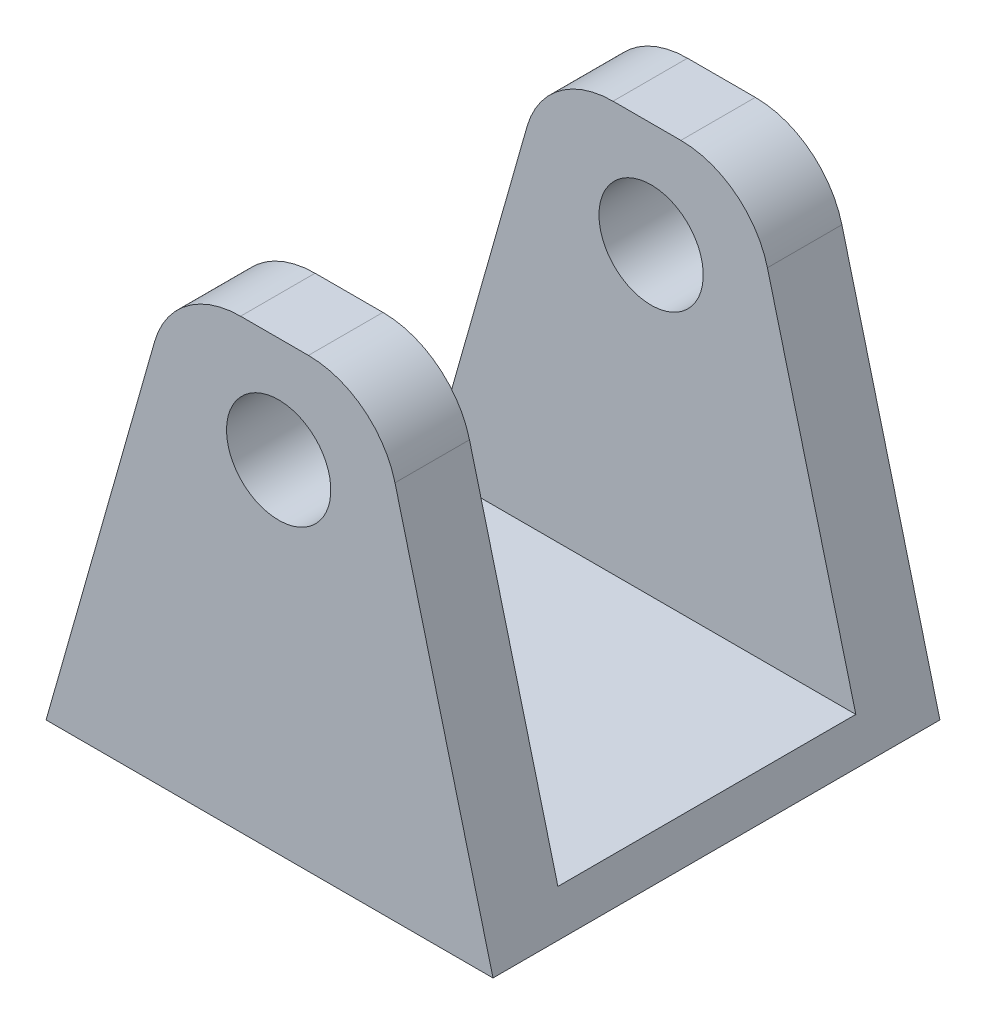
from build123d import *

# Parameters (mm, degrees)
CROQUIS1_R                 = 7
SALIENTE_EXTRUIR1_DEPTH    = 60
CORTAR_EXTRUIR1_DEPTH      = 95.568349883
CORTAR_EXTRUIR1_DEPTH_BACK = 95.568349883
CROQUIS2_W                 = 40
CROQUIS2_H                 = 110
CROQUIS3_R                 = 7
SALIENTE_EXTRUIR2_DEPTH    = 20


with BuildPart() as part:
    # Croquis1 → Saliente-Extruir1 (new body)
    with BuildSketch(Plane.XY):
        with BuildLine():
            Line((-50, -6.678589669), (-35.430635455, 44.601005707))
            ThreePointArc((-35.430635455, 44.601005707), (-31.120912301, 50.896250917), (-23.887487957, 53.321410331))
            Line((-23.887487957, 53.321410331), (-14.777953394, 53.321410331))
            ThreePointArc((-14.777953394, 53.321410331), (-7.428687176, 50.807625912), (-3.158499443, 44.319458007))
            Line((-3.158499443, 44.319458007), (10, -6.678589669))
            Line((10, -6.678589669), (-50, -6.678589669))
        make_face()
        with Locations(Location((-18.776351085, 39.16072457, 0), (0, 0, 180))):
            Circle(CROQUIS1_R, mode=Mode.SUBTRACT)
    extrude(amount=SALIENTE_EXTRUIR1_DEPTH)

    # Croquis2 → Cortar-Extruir1 (cut, two sides: drawn at the far end of the back side and taken through both)
    with BuildSketch(Plane(origin=(0, 0, 0), x_dir=(0, 0, -1), z_dir=(1, 0, 0)).offset(-CORTAR_EXTRUIR1_DEPTH_BACK)):
        with Locations((-30, 53.321410331)):
            Rectangle(CROQUIS2_W, CROQUIS2_H)
    extrude(amount=CORTAR_EXTRUIR1_DEPTH + CORTAR_EXTRUIR1_DEPTH_BACK, mode=Mode.SUBTRACT)

    # Croquis3 → Saliente-Extruir2 (add)
    with BuildSketch(Plane.XZ.offset(6.678589669)):
        with Locations(Location((-19.610005653, 29.155012249, 0), (0, 0, 180))):
            Circle(CROQUIS3_R)
    extrude(amount=SALIENTE_EXTRUIR2_DEPTH)


solid = part.part
